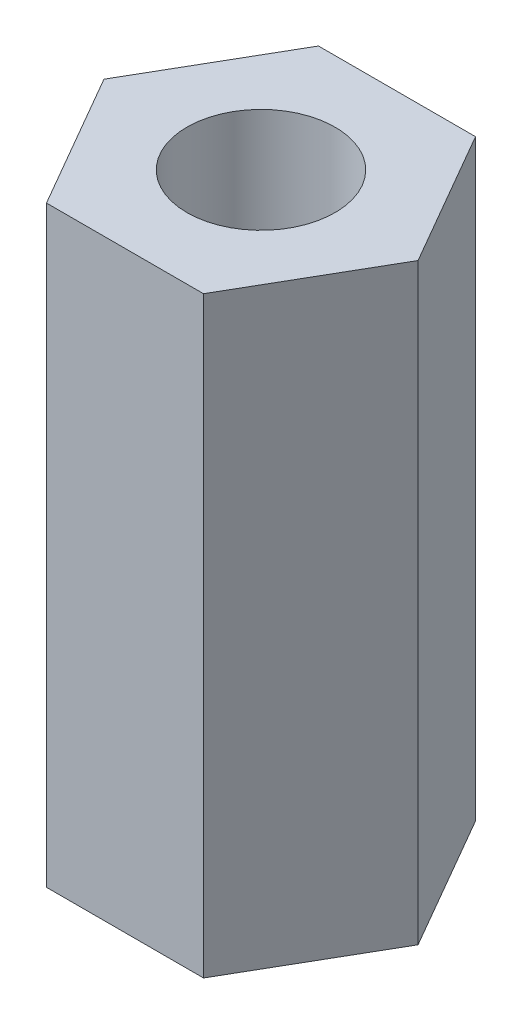
from build123d import *

# Parameters (mm, degrees)
BOSS_EXTRUDE1_DEPTH     = 10
TAP_DRILL_FOR_M3_TAP1_D = 2.5


with BuildPart() as part:
    # Sketch1 → Boss-Extrude1 (new body)
    with BuildSketch(Plane(origin=(0, 0, 0), x_dir=(1, 0, 0), z_dir=(0, 1, 0))):
        Polygon((2.65, 0), (1.325, 2.29496732), (-1.325, 2.29496732), (-2.65, 0), (-1.325, -2.29496732), (1.325, -2.29496732), align=None)
    extrude(amount=BOSS_EXTRUDE1_DEPTH)

    # Tap Drill for M3 Tap1 (through all)
    with Locations(Plane(origin=(0, 10, 0), x_dir=(1, 0, 0), z_dir=(0, 1, 0))):
        with Locations((0, 0)):
            Hole(TAP_DRILL_FOR_M3_TAP1_D / 2)


solid = part.part
